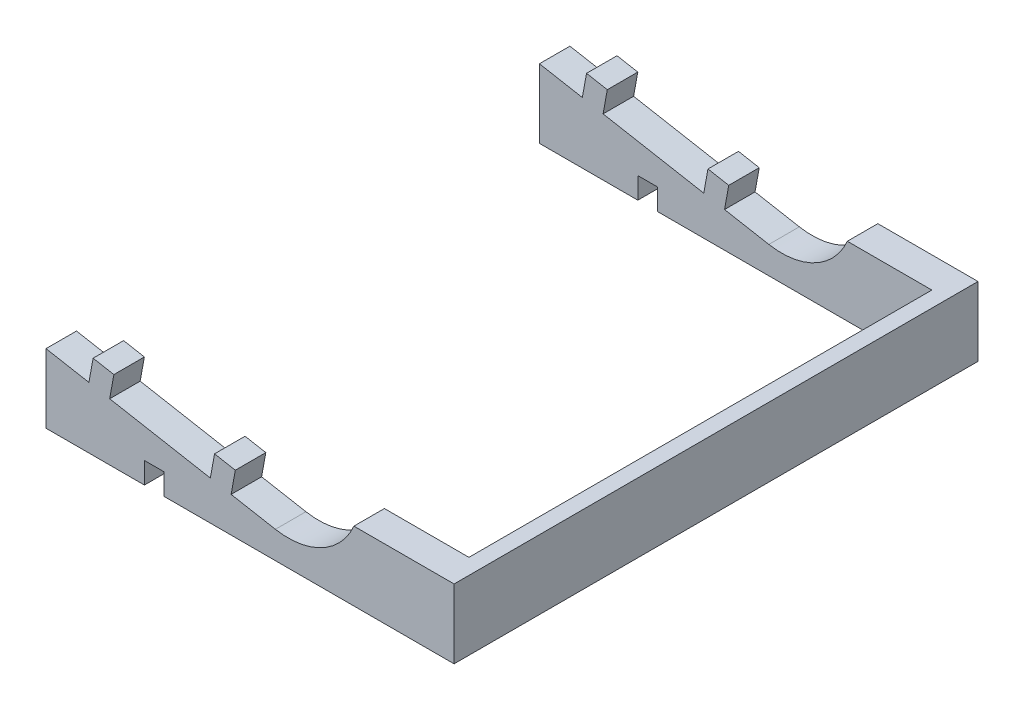
from build123d import *

# Parameters (mm, degrees)
BOSS_EXTRUDE1_DEPTH = 67
SKETCH2_W           = 59.2
SKETCH2_H           = 17.698005222
CUT_EXTRUDE1_DEPTH  = 50.18617341
SKETCH3_W           = 2.5
SKETCH3_H           = 2.875
CUT_EXTRUDE2_DEPTH  = 81.40340279


with BuildPart() as part:
    # Sketch1 → Boss-Extrude1 (new body)
    with BuildSketch(Plane.XY):
        with BuildLine():
            Line((-13.748013557, 3.628954741), (-19.413054129, 4.660133913))
            Line((-19.413054129, 4.660133913), (-18.875806853, 7.611636134))
            Line((-18.875806853, 7.611636134), (-21.532158853, 8.095158683))
            Line((-21.532158853, 8.095158683), (-22.069406129, 5.143656461))
            Line((-22.069406129, 5.143656461), (-34.942701024, 7.48691833))
            Line((-34.942701024, 7.48691833), (-34.405453748, 10.438420552))
            Line((-34.405453748, 10.438420552), (-37.061805748, 10.9219431))
            Line((-37.061805748, 10.9219431), (-37.599053024, 7.970440879))
            Line((-37.599053024, 7.970440879), (-43.08617341, 8.969234123))
            Line((-43.08617341, 8.969234123), (-43.08617341, 0.15))
            Line((-43.08617341, 0.15), (9.1, 0.15))
            Line((9.1, 0.15), (9.1, 8.999002611))
            Line((9.1, 8.999002611), (-3.711145872, 8.999002611))
            ThreePointArc((-3.711145872, 8.999002611), (-7.792859586, 4.563205458), (-13.748013557, 3.628954741))
        make_face()
    extrude(amount=BOSS_EXTRUDE1_DEPTH)

    # Sketch2 → Cut-Extrude1 (cut)
    with BuildSketch(Plane.ZY.offset(43.08617341)):
        with Locations((33.5, 8.999002611)):
            Rectangle(SKETCH2_W, SKETCH2_H)
    extrude(amount=-CUT_EXTRUDE1_DEPTH, mode=Mode.SUBTRACT)

    # Sketch3 → Cut-Extrude2 (cut, through all)
    with BuildSketch(Plane(origin=(0, 0, 0), x_dir=(-1, 0, 0), z_dir=(0, 0, -1))):
        with Locations((29.25, 1.4375)):
            Rectangle(SKETCH3_W, SKETCH3_H)
    extrude(amount=-CUT_EXTRUDE2_DEPTH, mode=Mode.SUBTRACT)


solid = part.part
